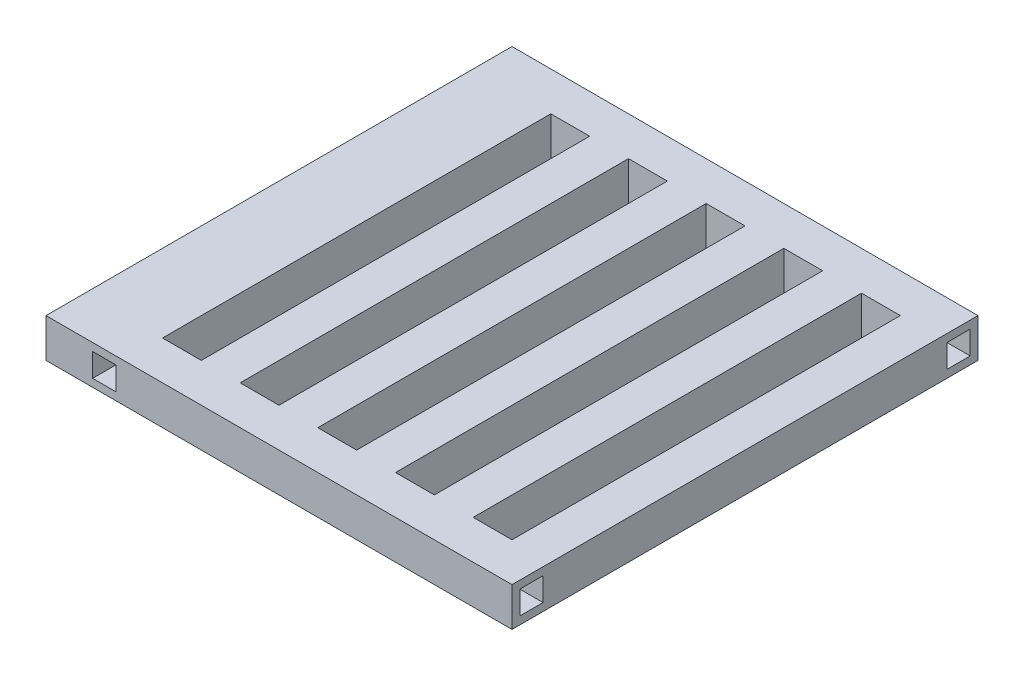
from build123d import *

# Parameters (mm, degrees)
SKETCH3_W           = 152.4
SKETCH3_H           = 152.4
BOSS_EXTRUDE1_DEPTH = 12.7
SKETCH5_W           = 147.32
SKETCH5_H           = 7.62
CUT_EXTRUDE1_DEPTH  = 12.7
SKETCH6_W           = 12.7
SKETCH6_H           = 127
CUT_EXTRUDE3_DEPTH  = 12.7
SKETCH8_W           = 7.62
SKETCH8_H           = 7.62
CUT_EXTRUDE4_DEPTH  = 25.4
SKETCH9_W           = 7.62
SKETCH9_H           = 7.62
CUT_EXTRUDE5_DEPTH  = 25.4
SKETCH10_W          = 7.508888552
SKETCH10_H          = 7.62
CUT_EXTRUDE6_DEPTH  = 25.4


with BuildPart() as part:
    # Sketch3 → Boss-Extrude1 (new body)
    with BuildSketch(Plane(origin=(0, 0, 0), x_dir=(1, 0, 0), z_dir=(0, 1, 0))):
        with Locations((-76.2, 76.2)):
            Rectangle(SKETCH3_W, SKETCH3_H)
    extrude(amount=BOSS_EXTRUDE1_DEPTH)

    # Sketch5 → Cut-Extrude1 (cut)
    with BuildSketch(Plane.ZY.offset(152.4)):
        with Locations((-76.2, 6.35)):
            Rectangle(SKETCH5_W, SKETCH5_H)
    extrude(amount=-CUT_EXTRUDE1_DEPTH, mode=Mode.SUBTRACT)

    # Sketch6 → Cut-Extrude3 (cut)
    with BuildSketch(Plane(origin=(0, 12.7, 0), x_dir=(1, 0, 0), z_dir=(0, 1, 0))):
        with Locations((-120.65, 76.2)):
            Rectangle(SKETCH6_W, SKETCH6_H)
        with Locations((-95.25, 76.2)):
            Rectangle(SKETCH6_W, SKETCH6_H)
        with Locations((-69.85, 76.2)):
            Rectangle(SKETCH6_W, SKETCH6_H)
        with Locations((-44.45, 76.2)):
            Rectangle(SKETCH6_W, SKETCH6_H)
        with Locations((-19.05, 76.2)):
            Rectangle(SKETCH6_W, SKETCH6_H)
    extrude(amount=-CUT_EXTRUDE3_DEPTH, mode=Mode.SUBTRACT)

    # Sketch8 → Cut-Extrude4 (cut)
    with BuildSketch(Plane(origin=(0, 0, 0), x_dir=(0, 0, -1), z_dir=(1, 0, 0))):
        with Locations((146.05, 6.35)):
            Rectangle(SKETCH8_W, SKETCH8_H)
        with Locations((6.35, 6.35)):
            Rectangle(SKETCH8_W, SKETCH8_H)
    extrude(amount=-CUT_EXTRUDE4_DEPTH, mode=Mode.SUBTRACT)

    # Sketch9 → Cut-Extrude5 (cut)
    with BuildSketch(Plane.XY):
        with Locations((-133.35, 6.35)):
            Rectangle(SKETCH9_W, SKETCH9_H)
    extrude(amount=-CUT_EXTRUDE5_DEPTH, mode=Mode.SUBTRACT)

    # Sketch10 → Cut-Extrude6 (cut)
    with BuildSketch(Plane(origin=(0, 0, -152.4), x_dir=(-1, 0, 0), z_dir=(0, 0, -1))):
        with Locations((133.405555724, 6.35)):
            Rectangle(SKETCH10_W, SKETCH10_H)
    extrude(amount=-CUT_EXTRUDE6_DEPTH, mode=Mode.SUBTRACT)


solid = part.part
